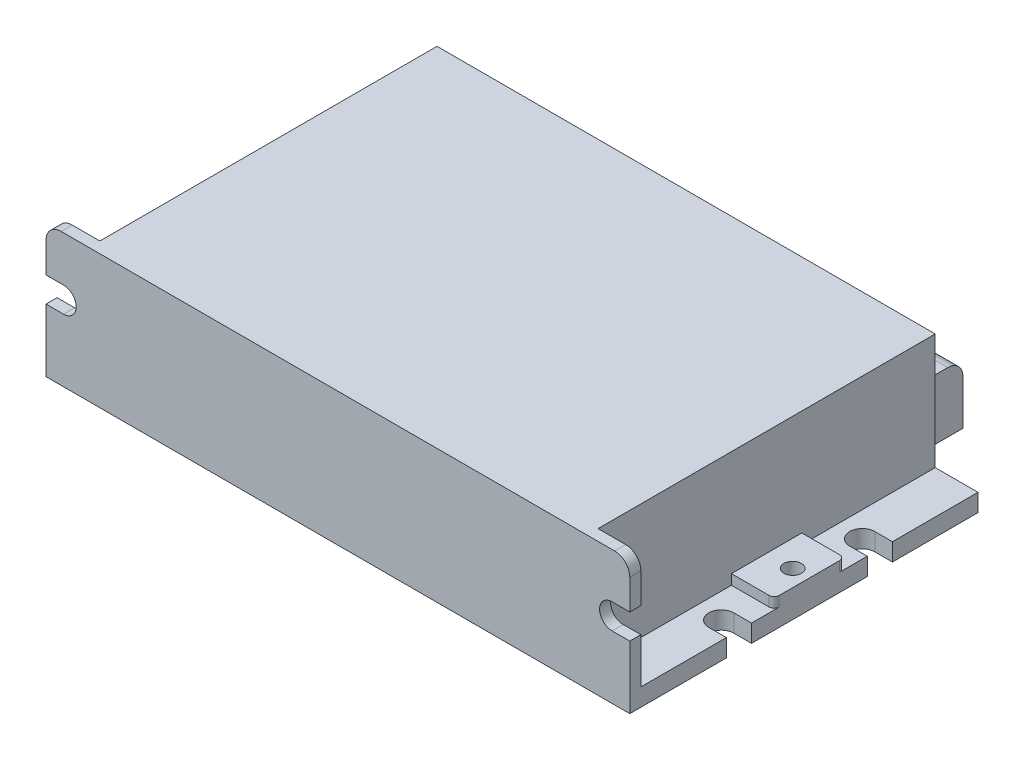
from build123d import *

# Parameters (mm, degrees)
SKETCH1_W           = 99
SKETCH1_H           = 67
BOSS_EXTRUDE1_DEPTH = 23
SKETCH2_W           = 116
SKETCH2_H           = 69.2
BOSS_EXTRUDE2_DEPTH = 3.5
SKETCH3_W           = 116
SKETCH3_H           = 2.2
BOSS_EXTRUDE3_DEPTH = 23
SKETCH4_W           = 91
SKETCH4_H           = 11.969413233
BOSS_EXTRUDE4_DEPTH = 9.5
FILLET1_R           = 3
FILLET2_R           = 3
CUT_EXTRUDE1_DEPTH  = 9.5
CUT_EXTRUDE2_DEPTH  = 9.5
BOSS_EXTRUDE5_DEPTH = 2
SKETCH9_R           = 1.727966507
CUT_EXTRUDE3_DEPTH  = 76.193084788


with BuildPart() as part:
    # Sketch1 → Boss-Extrude1 (new body)
    with BuildSketch(Plane(origin=(0, 0, 0), x_dir=(1, 0, 0), z_dir=(0, 1, 0))):
        Rectangle(SKETCH1_W, SKETCH1_H)
    extrude(amount=BOSS_EXTRUDE1_DEPTH)

    # Sketch2 → Boss-Extrude2 (add)
    with BuildSketch(Plane.XZ):
        with Locations((0, 1.1)):
            Rectangle(SKETCH2_W, SKETCH2_H)
    extrude(amount=BOSS_EXTRUDE2_DEPTH)

    # Sketch3 → Boss-Extrude3 (add)
    with BuildSketch(Plane(origin=(0, 0, 0), x_dir=(1, 0, 0), z_dir=(0, 1, 0))):
        with Locations((0, -34.6)):
            Rectangle(SKETCH3_W, SKETCH3_H)
    extrude(amount=BOSS_EXTRUDE3_DEPTH)

    # Sketch4 → Boss-Extrude4 (add)
    with BuildSketch(Plane(origin=(0, 0, -33.5), x_dir=(-1, 0, 0), z_dir=(0, 0, -1))):
        with Locations((0, 5.984706617)):
            Rectangle(SKETCH4_W, SKETCH4_H)
    extrude(amount=BOSS_EXTRUDE4_DEPTH)

    # Fillet1
    fillet1_edges = [part.edges().sort_by_distance(p)[0] for p in [
        (0, 11.969413233, -43),
    ]]
    fillet(fillet1_edges, radius=FILLET1_R)

    # Fillet2
    fillet2_edges = [part.edges().sort_by_distance(p)[0] for p in [
        (58, 23, 34.6),
        (-58, 23, 34.6),
    ]]
    fillet(fillet2_edges, radius=FILLET2_R)

    # Sketch5 → Cut-Extrude1 (cut)
    with BuildSketch(Plane.XY.offset(35.7)):
        with BuildLine():
            Line((-54.5, 14), (-58, 14))
            Line((-58, 14), (-58, 9))
            Line((-58, 9), (-54.5, 9))
            ThreePointArc((-54.5, 9), (-52, 11.5), (-54.5, 14))
        make_face()
        with BuildLine():
            Line((58, 9), (54.5, 9))
            ThreePointArc((54.5, 9), (52, 11.5), (54.5, 14))
            Line((54.5, 14), (58, 14))
            Line((58, 14), (58, 9))
        make_face()
    extrude(amount=-CUT_EXTRUDE1_DEPTH, mode=Mode.SUBTRACT)

    # Sketch6 → Cut-Extrude2 (cut)
    with BuildSketch(Plane(origin=(0, 0, 0), x_dir=(1, 0, 0), z_dir=(0, 1, 0))):
        with BuildLine():
            Line((54.5, 16.5), (58, 16.5))
            Line((58, 16.5), (58, 11.5))
            Line((58, 11.5), (54.5, 11.5))
            ThreePointArc((54.5, 11.5), (52, 14), (54.5, 16.5))
        make_face()
        with BuildLine():
            Line((54.5, -11.5), (58, -11.5))
            Line((58, -11.5), (58, -16.5))
            Line((58, -16.5), (54.5, -16.5))
            ThreePointArc((54.5, -16.5), (52, -14), (54.5, -11.5))
        make_face()
        with BuildLine():
            Line((-58, -16.5), (-54.5, -16.5))
            ThreePointArc((-54.5, -16.5), (-52, -14), (-54.5, -11.5))
            Line((-54.5, -11.5), (-58, -11.5))
            Line((-58, -11.5), (-58, -16.5))
        make_face()
        with BuildLine():
            Line((-58, 11.5), (-54.5, 11.5))
            ThreePointArc((-54.5, 11.5), (-52, 14), (-54.5, 16.5))
            Line((-54.5, 16.5), (-58, 16.5))
            Line((-58, 16.5), (-58, 11.5))
        make_face()
    extrude(amount=-CUT_EXTRUDE2_DEPTH, mode=Mode.SUBTRACT)

    # Sketch8 → Boss-Extrude5 (add)
    with BuildSketch(Plane(origin=(0, 0, 0), x_dir=(1, 0, 0), z_dir=(0, 1, 0))):
        with BuildLine():
            Line((-57, -7), (-49.5, -7))
            Line((-49.5, -7), (-49.5, 7))
            Line((-49.5, 7), (-57, 7))
            ThreePointArc((-57, 7), (-57.707106781, 6.707106781), (-58, 6))
            Line((-58, 6), (-58, -6))
            ThreePointArc((-58, -6), (-57.707106781, -6.707106781), (-57, -7))
        make_face()
        with BuildLine():
            Line((49.5, -7), (49.5, 7))
            Line((49.5, 7), (57, 7))
            ThreePointArc((57, 7), (57.707106781, 6.707106781), (58, 6))
            Line((58, 6), (58, -6))
            ThreePointArc((58, -6), (57.707106781, -6.707106781), (57, -7))
            Line((57, -7), (49.5, -7))
        make_face()
    extrude(amount=BOSS_EXTRUDE5_DEPTH)

    # Sketch9 → Cut-Extrude3 (cut, through all)
    with BuildSketch(Plane(origin=(0, 2, 0), x_dir=(1, 0, 0), z_dir=(0, 1, 0))):
        with Locations(Location((-54.678466494, 0, 0), (0, 0, 270))):
            Circle(SKETCH9_R)
        with Locations(Location((54.678466494, 0, 0), (0, 0, 90))):
            Circle(SKETCH9_R)
    extrude(amount=-CUT_EXTRUDE3_DEPTH, mode=Mode.SUBTRACT)


solid = part.part
